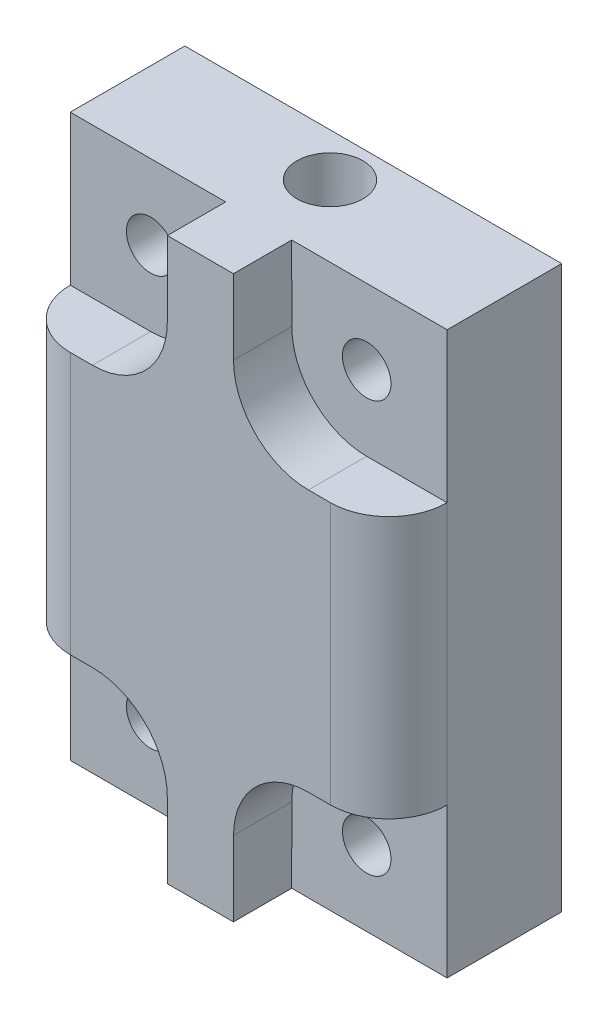
from build123d import *

# Parameters (mm, degrees)
SKETCH1_R           = 1.7
BOSS_EXTRUDE1_DEPTH = 28.9
CUT_EXTRUDE1_REACH  = 33.757
SKETCH2_R           = 1.25
CUT_EXTRUDE2_DEPTH  = 3
SKETCH4_R           = 3.5
SKETCH4_R_2         = 2.5
BOSS_EXTRUDE2_DEPTH = 0.4
CUT_EXTRUDE3_START  = -3.5
SKETCH5_R           = 2.5
CUT_EXTRUDE3_DEPTH  = 3.5


with BuildPart() as part:
    # Sketch1 → Boss-Extrude1 (new body)
    with BuildSketch(Plane(origin=(0, 0, 0), x_dir=(1, 0, 0), z_dir=(0, 1, 0))):
        with BuildLine():
            Line((-9.7, 0), (9.7, 0))
            Line((9.7, 0), (9.7, -5.9))
            ThreePointArc((9.7, -5.9), (8.821320344, -8.021320344), (6.7, -8.9))
            Line((6.7, -8.9), (-6.7, -8.9))
            ThreePointArc((-6.7, -8.9), (-8.821320344, -8.021320344), (-9.7, -5.9))
            Line((-9.7, -5.9), (-9.7, 0))
        make_face()
        with Locations(Location((0, -2.23, 0), (0, 0, 270))):
            Circle(SKETCH1_R, mode=Mode.SUBTRACT)
    extrude(amount=BOSS_EXTRUDE1_DEPTH)

    # Cut-Extrude1: up to this face of the body (flat: up to its plane)
    cut_extrude1_end = Plane(part.part.faces().sort_by_distance((0, 14.45, 8.9))[0])
    # Sketch2 → Cut-Extrude1 (cut, up to the picked face)
    with BuildSketch(Plane(origin=(0, 0, 0), x_dir=(-1, 0, 0), z_dir=(0, 0, -1)), mode=Mode.PRIVATE) as cut_extrude1_sk1:
        with Locations((5.56, 25.044233664)):
            Circle(SKETCH2_R)
    cut_extrude1_tool1 = split(extrude(cut_extrude1_sk1.sketch, amount=-CUT_EXTRUDE1_REACH, mode=Mode.PRIVATE), bisect_by=cut_extrude1_end, keep=Keep.BOTH, mode=Mode.PRIVATE)
    # Sketch2 → Cut-Extrude1 (cut, up to the picked face)
    with BuildSketch(Plane(origin=(0, 0, 0), x_dir=(-1, 0, 0), z_dir=(0, 0, -1)), mode=Mode.PRIVATE) as cut_extrude1_sk2:
        with Locations((5.56, 3.855766336)):
            Circle(SKETCH2_R)
    cut_extrude1_tool2 = split(extrude(cut_extrude1_sk2.sketch, amount=-CUT_EXTRUDE1_REACH, mode=Mode.PRIVATE), bisect_by=cut_extrude1_end, keep=Keep.BOTH, mode=Mode.PRIVATE)
    # Sketch2 → Cut-Extrude1 (cut, up to the picked face)
    with BuildSketch(Plane(origin=(0, 0, 0), x_dir=(-1, 0, 0), z_dir=(0, 0, -1)), mode=Mode.PRIVATE) as cut_extrude1_sk3:
        with Locations((-5.56, 3.855766336)):
            Circle(SKETCH2_R)
    cut_extrude1_tool3 = split(extrude(cut_extrude1_sk3.sketch, amount=-CUT_EXTRUDE1_REACH, mode=Mode.PRIVATE), bisect_by=cut_extrude1_end, keep=Keep.BOTH, mode=Mode.PRIVATE)
    # Sketch2 → Cut-Extrude1 (cut, up to the picked face)
    with BuildSketch(Plane(origin=(0, 0, 0), x_dir=(-1, 0, 0), z_dir=(0, 0, -1)), mode=Mode.PRIVATE) as cut_extrude1_sk4:
        with Locations((-5.56, 25.044233664)):
            Circle(SKETCH2_R)
    cut_extrude1_tool4 = split(extrude(cut_extrude1_sk4.sketch, amount=-CUT_EXTRUDE1_REACH, mode=Mode.PRIVATE), bisect_by=cut_extrude1_end, keep=Keep.BOTH, mode=Mode.PRIVATE)
    add(cut_extrude1_tool1.solids().sort_by(Axis((-5.56, 25.044234, 0), (0, 0, 1)))[0], mode=Mode.SUBTRACT)
    add(cut_extrude1_tool2.solids().sort_by(Axis((-5.56, 3.855766, 0), (0, 0, 1)))[0], mode=Mode.SUBTRACT)
    add(cut_extrude1_tool3.solids().sort_by(Axis((5.56, 3.855766, 0), (0, 0, 1)))[0], mode=Mode.SUBTRACT)
    add(cut_extrude1_tool4.solids().sort_by(Axis((5.56, 25.044234, 0), (0, 0, 1)))[0], mode=Mode.SUBTRACT)

    # Sketch3 → Cut-Extrude2 (cut)
    with BuildSketch(Plane.XY.offset(8.9)):
        with BuildLine():
            Line((5.56, 7.711532672), (9.7, 7.711532672))
            Line((9.7, 7.711532672), (9.7, 0))
            Line((9.7, 0), (1.7, 0))
            Line((1.7, 0), (1.704233664, 3.855766336))
            ThreePointArc((1.704233664, 3.855766336), (2.833561477, 6.582204859), (5.56, 7.711532672))
        make_face()
        with BuildLine():
            Line((5.56, 21.188467328), (9.7, 21.188467328))
            Line((9.7, 21.188467328), (9.7, 28.9))
            Line((9.7, 28.9), (1.7, 28.9))
            Line((1.7, 28.9), (1.704233664, 25.044233664))
            ThreePointArc((1.704233664, 25.044233664), (2.833561477, 22.317795141), (5.56, 21.188467328))
        make_face()
        with BuildLine():
            Line((-1.704233664, 3.855766336), (-1.7, 0))
            Line((-1.7, 0), (-9.7, 0))
            Line((-9.7, 0), (-9.7, 7.711532672))
            Line((-9.7, 7.711532672), (-5.56, 7.711532672))
            ThreePointArc((-5.56, 7.711532672), (-2.833561477, 6.582204859), (-1.704233664, 3.855766336))
        make_face()
        with BuildLine():
            Line((-9.7, 28.9), (-9.7, 21.188467328))
            Line((-9.7, 21.188467328), (-5.56, 21.188467328))
            ThreePointArc((-5.56, 21.188467328), (-2.833561477, 22.317795141), (-1.704233664, 25.044233664))
            Line((-1.704233664, 25.044233664), (-1.7, 28.9))
            Line((-1.7, 28.9), (-9.7, 28.9))
        make_face()
    extrude(amount=-CUT_EXTRUDE2_DEPTH, mode=Mode.SUBTRACT)

    # Sketch4 → Boss-Extrude2 (add)
    with BuildSketch(Plane(origin=(0, 0, 0), x_dir=(-1, 0, 0), z_dir=(0, 0, -1))):
        with Locations(Location((0, 14.45, 0), (0, 0, 180))):
            Circle(SKETCH4_R)
        with Locations((0, 14.45)):
            Circle(SKETCH4_R_2, mode=Mode.SUBTRACT)
    extrude(amount=BOSS_EXTRUDE2_DEPTH)

    # Sketch5 → Cut-Extrude3 (cut)
    with BuildSketch(Plane(origin=(0, 0, -0.4), x_dir=(-1, 0, 0), z_dir=(0, 0, -1)).offset(CUT_EXTRUDE3_START)):
        with Locations(Location((0, 14.45, 0), (0, 0, 234.253121961))):
            Circle(SKETCH5_R)
    extrude(amount=CUT_EXTRUDE3_DEPTH, mode=Mode.SUBTRACT)


solid = part.part
